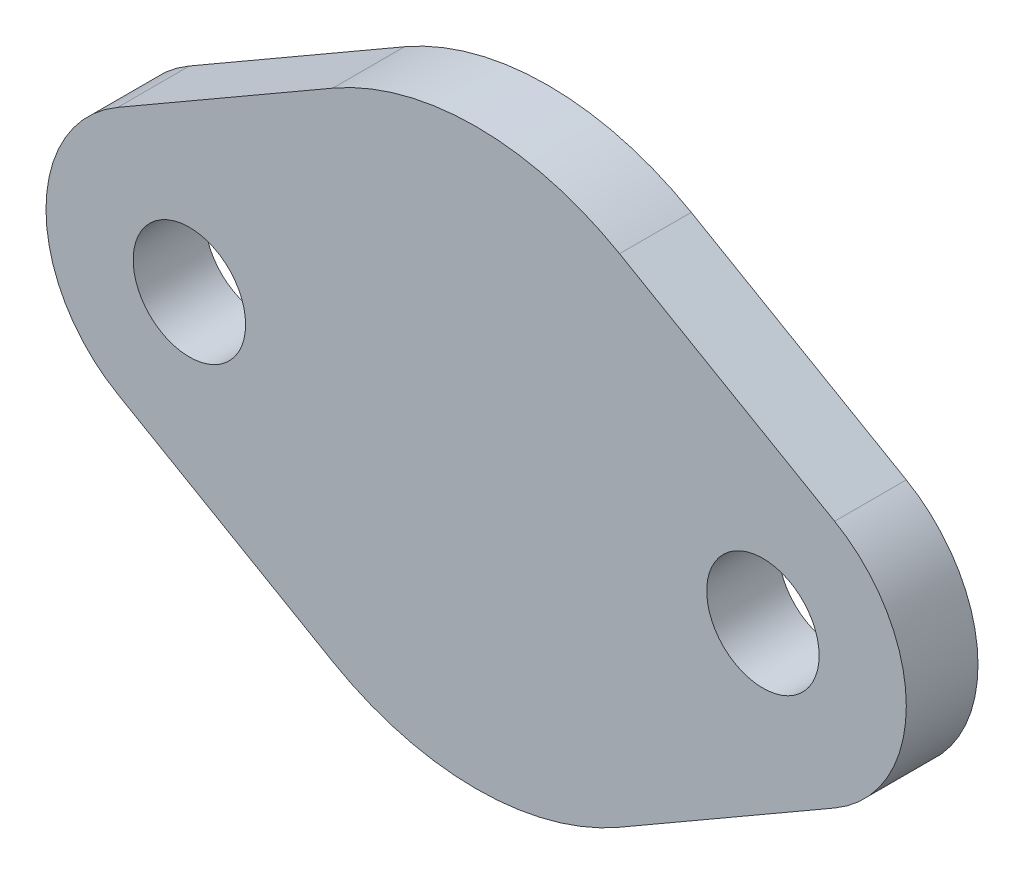
from build123d import *

# Parameters (mm, degrees)
SKETCH1_R           = 2.4892
BOSS_EXTRUDE1_DEPTH = 1.5875


with BuildPart() as part:
    # Sketch1 → Boss-Extrude1 (new, symmetric)
    with BuildSketch(Plane.XY):
        with BuildLine():
            Line((-15.875, 5.499261314), (-6.35, 10.998522628))
            ThreePointArc((-6.35, 10.998522628), (0, 12.7), (6.35, 10.998522628))
            Line((6.35, 10.998522628), (15.875, 5.499261314))
            ThreePointArc((15.875, 5.499261314), (19.05, 0), (15.875, -5.499261314))
            Line((15.875, -5.499261314), (6.35, -10.998522628))
            ThreePointArc((6.35, -10.998522628), (0, -12.7), (-6.35, -10.998522628))
            Line((-6.35, -10.998522628), (-15.875, -5.499261314))
            ThreePointArc((-15.875, -5.499261314), (-19.05, 0), (-15.875, 5.499261314))
        make_face()
        with Locations((-12.7, 0)):
            Circle(SKETCH1_R, mode=Mode.SUBTRACT)
        with Locations((12.7, 0)):
            Circle(SKETCH1_R, mode=Mode.SUBTRACT)
    extrude(amount=BOSS_EXTRUDE1_DEPTH, both=True)


solid = part.part
